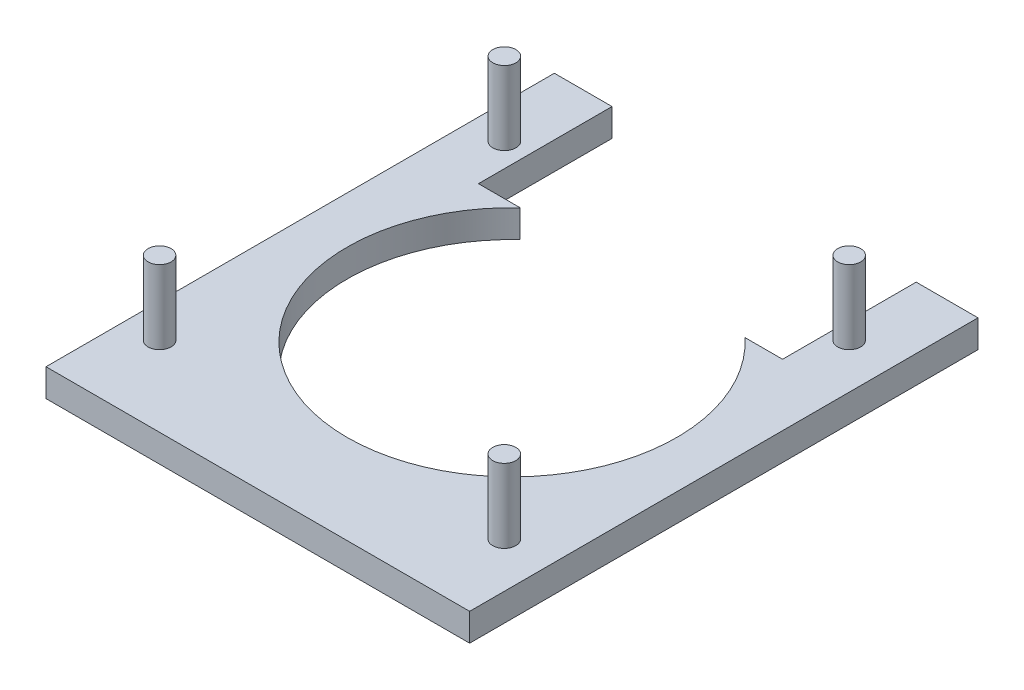
from build123d import *

# Parameters (mm, degrees)
SKETCH1_W           = 46
SKETCH1_H           = 55.2
BOSS_EXTRUDE1_DEPTH = 3
SKETCH4_W           = 33.02335113
SKETCH4_H           = 20.828153407
CUT_EXTRUDE1_DEPTH  = 8
SKETCH3_R           = 17.9
CUT_EXTRUDE2_DEPTH  = 8
SKETCH5_R           = 1.25
BOSS_EXTRUDE2_DEPTH = 8


with BuildPart() as part:
    # Sketch1 → Boss-Extrude1 (new body)
    with BuildSketch(Plane(origin=(0, 0, 0), x_dir=(1, 0, 0), z_dir=(0, 1, 0))):
        Rectangle(SKETCH1_W, SKETCH1_H)
    extrude(amount=BOSS_EXTRUDE1_DEPTH)

    # Sketch4 → Cut-Extrude1 (cut)
    with BuildSketch(Plane(origin=(0, 3, 0), x_dir=(1, 0, 0), z_dir=(0, 1, 0))):
        with Locations((-0.224140392, 23.506208916)):
            Rectangle(SKETCH4_W, SKETCH4_H)
    extrude(amount=-CUT_EXTRUDE1_DEPTH, mode=Mode.SUBTRACT)

    # Sketch3 → Cut-Extrude2 (cut)
    with BuildSketch(Plane(origin=(0, 3, 0), x_dir=(1, 0, 0), z_dir=(0, 1, 0))):
        Circle(SKETCH3_R)
    extrude(amount=-CUT_EXTRUDE2_DEPTH, mode=Mode.SUBTRACT)

    # Sketch5 → Boss-Extrude2 (add)
    with BuildSketch(Plane(origin=(0, 3, 0), x_dir=(1, 0, 0), z_dir=(0, 1, 0))):
        with Locations(Location((-19.317913276, 18.489975821, 0), (0, 0, 90))):
            Circle(SKETCH5_R)
        with Locations(Location((18.122086724, 18.489975821, 0), (0, 0, 90))):
            Circle(SKETCH5_R)
        with Locations(Location((-19.317913276, -18.950024179, 0), (0, 0, 90))):
            Circle(SKETCH5_R)
        with Locations(Location((18.084134894, -18.924464602, 0), (0, 0, 90))):
            Circle(SKETCH5_R)
    extrude(amount=BOSS_EXTRUDE2_DEPTH)


solid = part.part
